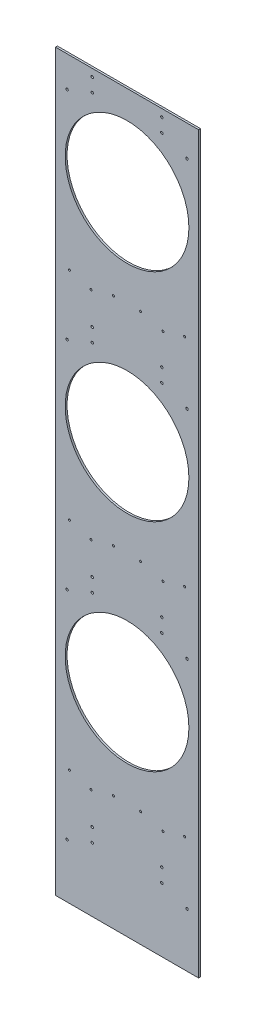
from build123d import *

# Parameters (mm, degrees)
SKETCH1_W                      = 469.9
SKETCH1_H                      = 2413
SKETCH1_R                      = 203.2
BOSS_EXTRUDE1_DEPTH            = 6.35
F_1_4_CLEARANCE_HOLE1_D        = 6.7564
F_5_16_0_3125_DIAMETER_HOLE1_D = 7.9375


with BuildPart() as part:
    # Sketch1 → Boss-Extrude1 (new body)
    with BuildSketch(Plane.XY):
        with Locations((0, 1206.5)):
            Rectangle(SKETCH1_W, SKETCH1_H)
        with Locations((0, 695.96)):
            Circle(SKETCH1_R, mode=Mode.SUBTRACT)
        with Locations((0, 1407.16)):
            Circle(SKETCH1_R, mode=Mode.SUBTRACT)
        with Locations((0, 2118.36)):
            Circle(SKETCH1_R, mode=Mode.SUBTRACT)
    extrude(amount=BOSS_EXTRUDE1_DEPTH)

    # 1/4 Clearance Hole1 (through all)
    with Locations(Plane.XY.offset(6.35)):
        with Locations((44.571271172, 378.545152647), (118.174819136, 358.82314141), (-44.571271172, 378.545152647), (-118.174819136, 358.82314141), (44.571271172, 1089.745152647), (118.174819136, 1070.02314141), (-44.571271172, 1089.745152647), (-118.174819136, 1070.02314141), (44.571271172, 1800.945152647), (118.174819136, 1781.22314141), (-44.571271172, 1800.945152647), (-118.174819136, 1781.22314141), (189.372114723, 379.189906028), (-189.372114723, 379.189906028), (-189.372114723, 1090.389906028), (-189.372114723, 1801.589906028), (189.372114723, 1801.589906028), (189.372114723, 1090.389906028)):
            Hole(F_1_4_CLEARANCE_HOLE1_D / 2)

    # 5/16 (0.3125) Diameter Hole1 (through all)
    with Locations(Plane.XY.offset(6.35)):
        with Locations((-114.3, 254.635), (-114.3, 210.185), (-196.85, 177.8), (196.85, 177.8), (114.3, 210.185), (114.3, 254.635), (-114.3, 965.835), (-114.3, 921.385), (-196.85, 889), (196.85, 889), (114.3, 921.385), (114.3, 965.835), (-114.3, 1677.035), (-114.3, 1632.585), (-196.85, 1600.2), (196.85, 1600.2), (114.3, 1632.585), (114.3, 1677.035), (-114.3, 2388.235), (-114.3, 2343.785), (-196.85, 2311.4), (196.85, 2311.4), (114.3, 2343.785), (114.3, 2388.235)):
            Hole(F_5_16_0_3125_DIAMETER_HOLE1_D / 2)


solid = part.part
